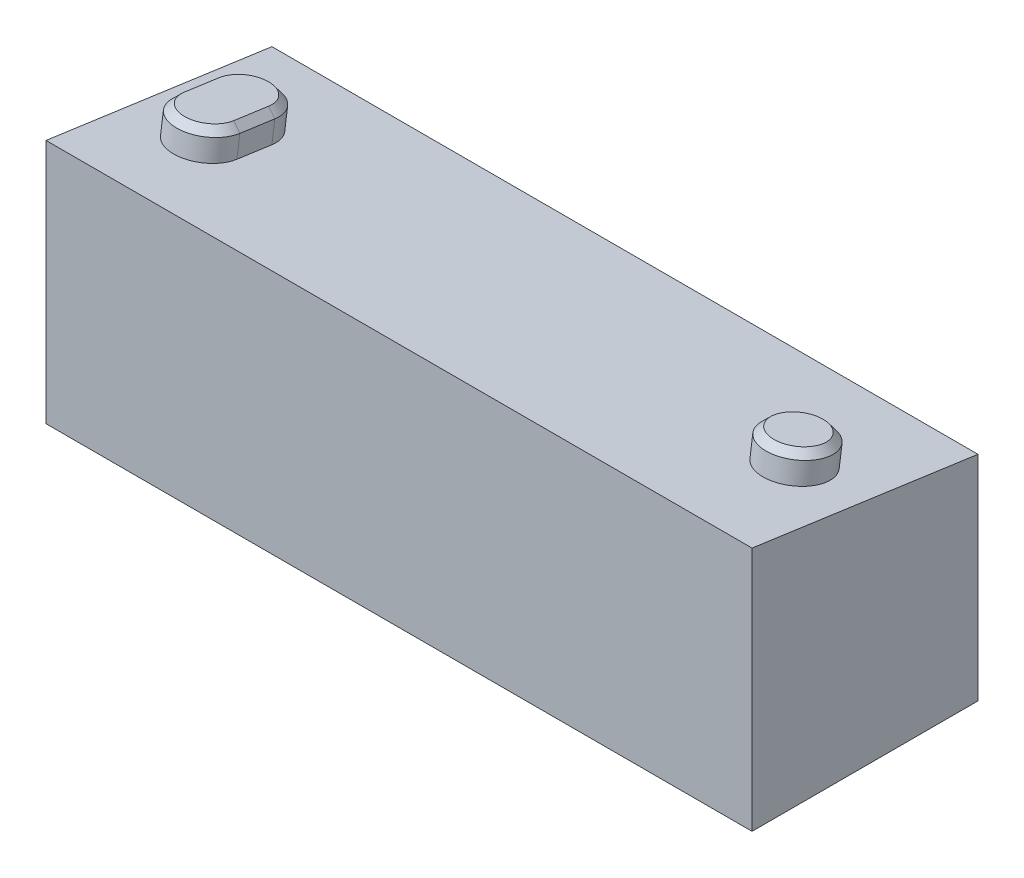
from build123d import *

# Parameters (mm, degrees)
EXTRUDE_1_DEPTH     = 16
CUT_EXTRUDE_1_DEPTH = 50
EXTRUDE_2_DEPTH     = 28.5
SKETCH_4_R          = 4.5
CUT_EXTRUDE_2_DEPTH = 28.5
EXTRUDE_3_DEPTH     = 50
EXTRUDE_START       = 4
SKETCH_6_R          = 4.5
EXTRUDE_4_DEPTH     = 4
CUT_EXTRUDE_3_DEPTH = 60
CHAMFER_1_SIZE      = 1


with BuildPart() as part:
    # 草图1 → 凸台-拉伸1 (new, symmetric)
    with BuildSketch(Plane.XY):
        with BuildLine():
            Line((-17, 0), (-17, -66.86388681))
            Line((-17, -66.86388681), (-20.5, -66.86388681))
            Line((-20.5, -66.86388681), (-20.5, 0))
            ThreePointArc((-20.5, 0), (0, 20.5), (20.5, 0))
            Line((20.5, 0), (20.5, -66.86388681))
            Line((20.5, -66.86388681), (17, -66.86388681))
            Line((17, -66.86388681), (17, 0))
            ThreePointArc((17, 0), (0, 17), (-17, 0))
        make_face()
    extrude(amount=EXTRUDE_1_DEPTH, both=True)

    # 草图2 → 切除-拉伸1 (cut, symmetric)
    with BuildSketch(Plane(origin=(0, 0, 0), x_dir=(0, 0, -1), z_dir=(1, 0, 0))):
        Polygon((16, -42.748653355), (-16, -38.251346645), (-16, -66.86388681), (16, -66.86388681), align=None)
    extrude(amount=CUT_EXTRUDE_1_DEPTH, both=True, mode=Mode.SUBTRACT)

    # 草图3 → 凸台-拉伸2 (add)
    with BuildSketch(Plane.ZY.offset(20.5)):
        Polygon((-16, -42.748653355), (16, -38.251346645), (16, -34.716950141), (-16, -39.214256851), align=None)
    extrude_2 = extrude(amount=EXTRUDE_2_DEPTH)

    # 镜向1: 凸台-拉伸2 across plane
    add(extrude_2.mirror(Plane(origin=(0, 0, 0), x_dir=(0, 0, 1), z_dir=(1, 0, 0))))

    # 草图4 → 切除-拉伸2 (cut)
    with BuildSketch(Plane(origin=(0, -36.249611102, 5.094550602), x_dir=(1, 0, 0), z_dir=(0, 0.9902680687415715, -0.13917310096005808))):
        with Locations(Location((40.5, 5.144617667, 0), (0, 0, 270))):
            Circle(SKETCH_4_R)
        with BuildLine():
            Line((-36, 7.644617667), (-36, 2.644617667))
            ThreePointArc((-36, 2.644617667), (-40.5, -1.855382333), (-45, 2.644617667))
            Line((-45, 2.644617667), (-45, 7.644617667))
            ThreePointArc((-45, 7.644617667), (-40.5, 12.144617667), (-36, 7.644617667))
        make_face()
    extrude(amount=-CUT_EXTRUDE_2_DEPTH, mode=Mode.SUBTRACT)

    # 草图8 → 切除-拉伸3 (cut, symmetric)
    with BuildSketch(Plane(origin=(0, 0, 0), x_dir=(0, 0, -1), z_dir=(1, 0, 0))):
        Polygon((16, -42.748653355), (-16, -38.251346645), (-16, 32.293524638), (16, 32.293524638), align=None)
    extrude(amount=CUT_EXTRUDE_3_DEPTH, both=True, mode=Mode.SUBTRACT)


with BuildPart() as body_2:
    # 草图5 → 凸台-拉伸3 (new, symmetric)
    with BuildSketch(Plane(origin=(0, 0, 0), x_dir=(0, 0, -1), z_dir=(1, 0, 0))):
        Polygon((16, -42.748653355), (-16, -38.251346645), (-16, -72.998653355), (16, -72.998653355), align=None)
    extrude(amount=EXTRUDE_3_DEPTH, both=True)

    # 草图6 → 凸台-拉伸4 (add)
    with BuildSketch(Plane(origin=(0, -39.715549343, 5.581656455), x_dir=(1, 0, 0), z_dir=(0, 0.9902680687415714, -0.139173100960058)).offset(EXTRUDE_START)):
        with Locations(Location((40.5, 5.144617667, 0), (0, 0, 90))):
            Circle(SKETCH_6_R)
        with BuildLine():
            Line((-36, 2.644617667), (-36, 7.644617667))
            ThreePointArc((-36, 7.644617667), (-40.5, 12.144617667), (-45, 7.644617667))
            Line((-45, 7.644617667), (-45, 2.644617667))
            ThreePointArc((-45, 2.644617667), (-40.5, -1.855382333), (-36, 2.644617667))
        make_face()
    extrude(amount=-EXTRUDE_4_DEPTH)

    # 倒角1
    chamfer_1_edges = [body_2.edges().sort_by_distance(p)[0] for p in [
        (-40.5, -35.496257755, 6.862289931),
        (-36, -36.470469462, -0.06958655),
        (-40.5, -37.444681169, -7.001463032),
        (-45, -36.470469462, -0.06958655),
        (40.5, -35.844190507, 4.386619759),
    ]]
    chamfer(chamfer_1_edges, length=CHAMFER_1_SIZE)


solid = body_2.part
